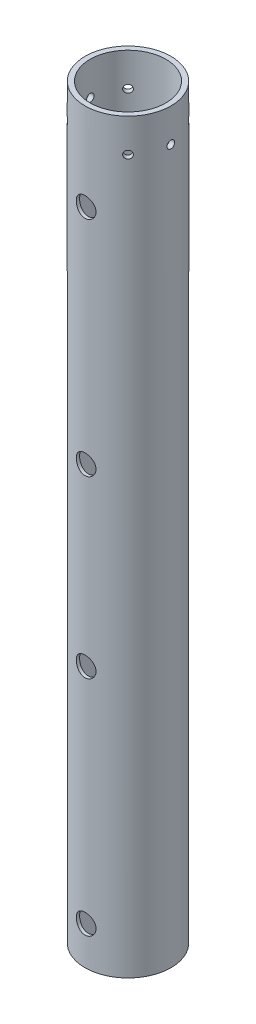
from build123d import *

# Parameters (mm, degrees)
SKETCH_1_R          = 135
SKETCH_1_R_2        = 125
EXTRUDE_1_DEPTH     = 2335
EXTRUDE_4_DEPTH     = 250
SKETCH_4_R          = 31
CUT_EXTRUDE_1_DEPTH = 2424.566586665
EXTRUDE_START       = -210
SKETCH_5_R          = 125
SKETCH_5_R_2        = 119
EXTRUDE_5_DEPTH     = 210
SKETCH_7_R          = 12
CUT_EXTRUDE_3_DEPTH = 2398.639464269
SKETCH_8_R          = 12
CUT_EXTRUDE_4_DEPTH = 2398.639464269
SKETCH_9_R          = 12
CUT_EXTRUDE_5_DEPTH = 2424.566586793


with BuildPart() as part:
    # 草图1 → 凸台-拉伸1 (new body)
    with BuildSketch(Plane(origin=(0, 0, 0), x_dir=(1, 0, 0), z_dir=(0, 1, 0))):
        with Locations(Location((0, 0, 0), (0, 0, 270))):
            Circle(SKETCH_1_R)
        with Locations(Location((0, 0, 0), (0, 0, 270))):
            Circle(SKETCH_1_R_2, mode=Mode.SUBTRACT)
    extrude(amount=EXTRUDE_1_DEPTH)

    # 草图2 → 旋转1 (revolve)
    with BuildSketch(Plane.XY):
        with BuildLine():
            Line((0, 0), (135, 0))
            Line((135, 0), (135, -10))
            ThreePointArc((135, -10), (68.23672032, -24.972862159), (0, -30))
            Line((0, -30), (0, 0))
        make_face()
    revolve(axis=Axis((0, -1000, 0), (0, 1, 0)))

    # 草图3 → 凸台-拉伸4 (add)
    with BuildSketch(Plane(origin=(0, 0, 0), x_dir=(1, 0, 0), z_dir=(0, 1, 0))):
        with BuildLine():
            Line((-124.899959968, 5), (-50, 5))
            Line((-50, 5), (-50, 114.564392374))
            ThreePointArc((-50, 114.564392374), (-45.041428783, 116.603043241), (-40, 118.427192823))
            Line((-40, 118.427192823), (-40, 5))
            Line((-40, 5), (40, 5))
            Line((40, 5), (40, 118.427192823))
            ThreePointArc((40, 118.427192823), (45.041428783, 116.603043241), (50, 114.564392374))
            Line((50, 114.564392374), (50, 5))
            Line((50, 5), (124.899959968, 5))
            ThreePointArc((124.899959968, 5), (125, 0), (124.899959968, -5))
            Line((124.899959968, -5), (50, -5))
            Line((50, -5), (50, -114.564392374))
            ThreePointArc((50, -114.564392374), (45.041428783, -116.603043241), (40, -118.427192823))
            Line((40, -118.427192823), (40, -5))
            Line((40, -5), (-40, -5))
            Line((-40, -5), (-40, -118.427192823))
            ThreePointArc((-40, -118.427192823), (-45.041428783, -116.603043241), (-50, -114.564392374))
            Line((-50, -114.564392374), (-50, -5))
            Line((-50, -5), (-124.899959968, -5))
            ThreePointArc((-124.899959968, -5), (-125, 0), (-124.899959968, 5))
        make_face()
    extrude(amount=EXTRUDE_4_DEPTH)

    # 草图4 → 切除-拉伸1 (cut, through all)
    with BuildSketch(Plane.XY.offset(500)):
        with Locations((0, 2060)):
            Circle(SKETCH_4_R)
        with Locations((0, 1360)):
            Circle(SKETCH_4_R)
        with Locations((0, 110)):
            Circle(SKETCH_4_R)
        with Locations((0, 810)):
            Circle(SKETCH_4_R)
    extrude(amount=-CUT_EXTRUDE_1_DEPTH, mode=Mode.SUBTRACT)

    # 草图5 → 凸台-拉伸5 (add)
    with BuildSketch(Plane(origin=(0, 2335, 0), x_dir=(1, 0, 0), z_dir=(0, 1, 0)).offset(EXTRUDE_START)):
        with Locations(Location((0, 0, 0), (0, 0, 71.337075115))):
            Circle(SKETCH_5_R)
        with Locations(Location((0, 0, 0), (0, 0, 270))):
            Circle(SKETCH_5_R_2, mode=Mode.SUBTRACT)
    extrude(amount=EXTRUDE_5_DEPTH)

    # 草图7 → 切除-拉伸3 (cut, through all)
    with BuildSketch(Plane(origin=(-250, 0, 250), x_dir=(-0.7071067811865476, 0, -0.7071067811865476), z_dir=(0.7071067811865476, 0, -0.7071067811865476))):
        with Locations(Location((0, 2230, 0), (0, 0, 180))):
            Circle(SKETCH_7_R)
    extrude(amount=CUT_EXTRUDE_3_DEPTH, mode=Mode.SUBTRACT)

    # 草图8 → 切除-拉伸4 (cut, through all)
    with BuildSketch(Plane(origin=(250, 0, 250), x_dir=(0.7071067811865476, 0, -0.7071067811865476), z_dir=(0.7071067811865476, 0, 0.7071067811865476))):
        with Locations((0, 2230)):
            Circle(SKETCH_8_R)
    extrude(amount=-CUT_EXTRUDE_4_DEPTH, mode=Mode.SUBTRACT)

    # 草图9 → 切除-拉伸5 (cut, through all)
    with BuildSketch(Plane(origin=(500, 0, 0), x_dir=(0, 0, -1), z_dir=(1, 0, 0))):
        with Locations((0, 2230)):
            Circle(SKETCH_9_R)
    extrude(amount=-CUT_EXTRUDE_5_DEPTH, mode=Mode.SUBTRACT)


solid = part.part
